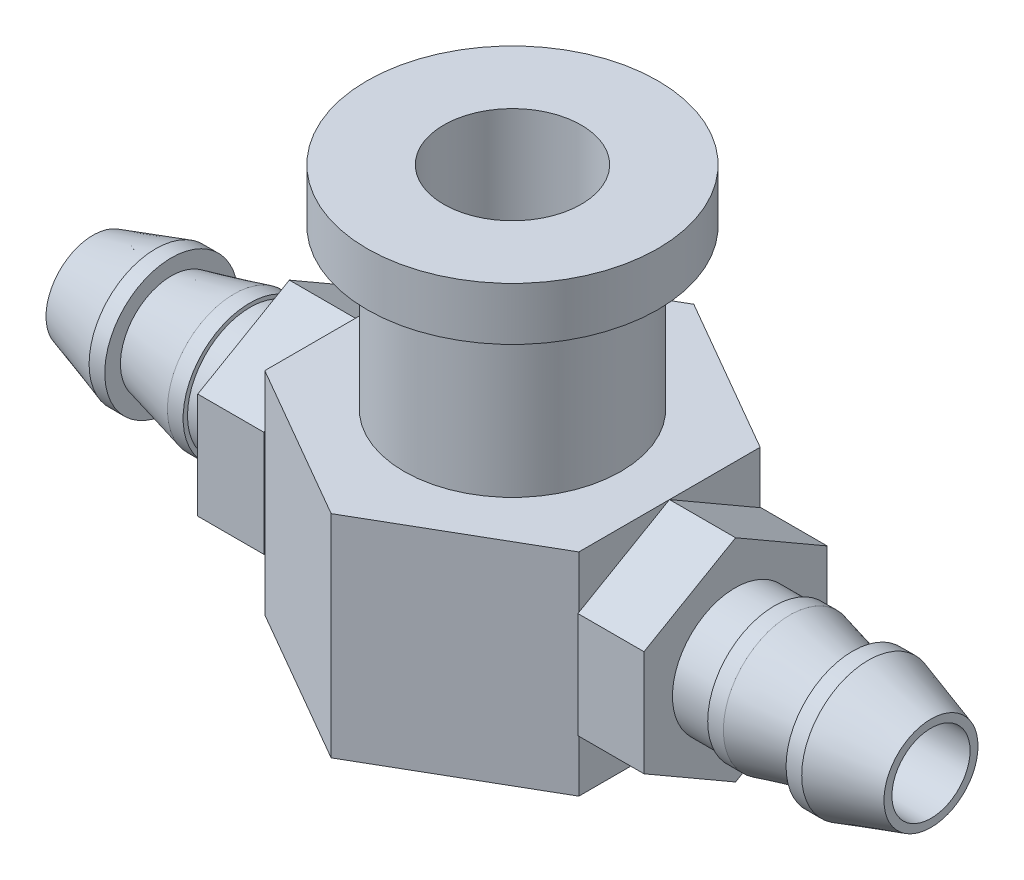
from build123d import *

# Parameters (mm, degrees)
SKETCH1_R            = 5.5
SKETCH1_R_2          = 4.1
BOSS_EXTRUDE1_DEPTH  = 2
SKETCH2_R            = 4.1
BOSS_EXTRUDE2_DEPTH  = 8
SKETCH4_R            = 2.6
BOSS_EXTRUDE3_DEPTH  = 22
BOSS_EXTRUDE4_DEPTH  = 8
BOSS_EXTRUDE5_DEPTH  = 2.5
BOSS_EXTRUDE6_DEPTH  = 2.5
SKETCH8_R            = 2.6
CUT_EXTRUDE1_DEPTH   = 16
SKETCH9_R            = 2.37037037
BOSS_EXTRUDE7_DEPTH  = 1.481481481
SKETCH10_R           = 2.37037037
BOSS_EXTRUDE8_DEPTH  = 1.481481481
SKETCH11_R           = 2.518518519
BOSS_EXTRUDE9_DEPTH  = 0.592592593
SKETCH13_R           = 2.518518519
SKETCH12_R           = 1.925925926
SKETCH14_R           = 2.51851852
BOSS_EXTRUDE10_DEPTH = 0.592592593
SKETCH16_R           = 2.51851852
SKETCH15_R           = 1.77777778
SKETCH17_R           = 1.47777778
CUT_EXTRUDE2_DEPTH   = 31.691734637
SKETCH18_R           = 2.6
CUT_EXTRUDE3_DEPTH   = 6
SKETCH21_R           = 4
CUT_EXTRUDE4_DEPTH   = 2


with BuildPart() as part:
    # Sketch1 → Boss-Extrude1 (new body)
    with BuildSketch(Plane(origin=(0, 0, 0), x_dir=(1, 0, 0), z_dir=(0, 1, 0))):
        with Locations(Location((0, 0, 0), (0, 0, 270))):
            Circle(SKETCH1_R)
        with Locations(Location((0, 0, 0), (0, 0, 270))):
            Circle(SKETCH1_R_2, mode=Mode.SUBTRACT)
    extrude(amount=BOSS_EXTRUDE1_DEPTH)



with BuildPart() as body_2:
    # Sketch2 → Boss-Extrude2 (new body)
    with BuildSketch(Plane(origin=(0, 2, 0), x_dir=(1, 0, 0), z_dir=(0, 1, 0))):
        with Locations(Location((0, 0, 0), (0, 0, 270))):
            Circle(SKETCH2_R)
    extrude(amount=-BOSS_EXTRUDE2_DEPTH)


with BuildPart() as part_1:
    add(part.part)

    add(body_2.part)  # Boss-Extrude3 merges body 2
    # Sketch4 → Boss-Extrude3 (add)
    with BuildSketch(Plane(origin=(0, 2, 0), x_dir=(1, 0, 0), z_dir=(0, 1, 0))):
        with Locations(Location((0, 0, 0), (0, 0, 270))):
            Circle(SKETCH4_R)
    extrude(amount=-BOSS_EXTRUDE3_DEPTH)

    # Sketch5 → Boss-Extrude4 (add)
    with BuildSketch(Plane.XZ.offset(6)):
        Polygon((5.938459912, -3.428571429), (5.938459912, 3.428571429), (0, 6.857142857), (-5.938459912, 3.428571429), (-5.938459912, -3.428571429), (0, -6.857142857), align=None)
    extrude(amount=BOSS_EXTRUDE4_DEPTH)

    # Sketch6 → Boss-Extrude5 (add)
    with BuildSketch(Plane(origin=(5.938459912, 0, 0), x_dir=(0, 0, -1), z_dir=(1, 0, 0))):
        Polygon((0, -14), (3.464101615, -12), (3.464101615, -8), (0, -6), (-3.464101615, -8), (-3.464101615, -12), align=None)
    extrude(amount=BOSS_EXTRUDE5_DEPTH)

    # Sketch7 → Boss-Extrude6 (add)
    with BuildSketch(Plane.ZY.offset(5.938459912)):
        Polygon((0, -14), (3.464101615, -12), (3.464101615, -8), (0, -6), (-3.464101615, -8), (-3.464101615, -12), align=None)
    extrude(amount=BOSS_EXTRUDE6_DEPTH)

    # Sketch8 → Cut-Extrude1 (cut)
    with BuildSketch(Plane(origin=(0, 2, 0), x_dir=(1, 0, 0), z_dir=(0, 1, 0))):
        with Locations(Location((0, 0, 0), (0, 0, 270))):
            Circle(SKETCH8_R)
    extrude(amount=-CUT_EXTRUDE1_DEPTH, mode=Mode.SUBTRACT)


with BuildPart() as cut_extrude1_piece_1:
    # of the separate pieces the step leaves, piece 1, a body of its own (cut_extrude1_pieces)
    add(part_1.part.solids().sort_by_distance((0, 2, 5.5))[0])

    # Sketch9 → Boss-Extrude7 (add)
    with BuildSketch(Plane(origin=(8.438459912, 0, 0), x_dir=(0, 0, -1), z_dir=(1, 0, 0))):
        with Locations((-0.017765093, -10)):
            Circle(SKETCH9_R)
    extrude(amount=BOSS_EXTRUDE7_DEPTH)

    # Sketch10 → Boss-Extrude8 (add)
    with BuildSketch(Plane.ZY.offset(8.438459912)):
        with Locations((0, -10)):
            Circle(SKETCH10_R)
    extrude(amount=BOSS_EXTRUDE8_DEPTH)

    # Sketch11 → Boss-Extrude9 (add)
    with BuildSketch(Plane(origin=(9.919941393, 0, 0), x_dir=(0, 0, -1), z_dir=(1, 0, 0))):
        with Locations((-0.017765093, -10)):
            Circle(SKETCH11_R)
    boss_extrude9 = extrude(amount=BOSS_EXTRUDE9_DEPTH)

    # Sketch13 → Loft1 section 0
    with BuildSketch(Plane(origin=(10.512533986, 0, 0), x_dir=(0, 0, -1), z_dir=(1, 0, 0))):
        with Locations((-0.017765093, -10)):
            Circle(SKETCH13_R)
    # Sketch12 → Loft1 section 1
    with BuildSketch(Plane(origin=(12.882904356, 0, 0), x_dir=(0, 0, -1), z_dir=(1, 0, 0))):
        with Locations((-0.017765093, -10)):
            Circle(SKETCH12_R)
    loft1 = loft()

    # Sketch14 → Boss-Extrude10 (add)
    with BuildSketch(Plane(origin=(12.882904356, 0, 0), x_dir=(0, 0, -1), z_dir=(1, 0, 0))):
        with Locations(Location((-0.017765093, -10, 0), (0, 0, 180))):
            Circle(SKETCH14_R)
    boss_extrude10 = extrude(amount=BOSS_EXTRUDE10_DEPTH)

    # Sketch16 → Loft2 section 0
    with BuildSketch(Plane(origin=(13.475496948, 0, 0), x_dir=(0, 0, -1), z_dir=(1, 0, 0))):
        with Locations((-0.017765093, -10)):
            Circle(SKETCH16_R)
    # Sketch15 → Loft2 section 1
    with BuildSketch(Plane(origin=(15.845867318, 0, 0), x_dir=(0, 0, -1), z_dir=(1, 0, 0))):
        with Locations((-0.017765093, -10)):
            Circle(SKETCH15_R)
    loft2 = loft()

    # Mirror1: Boss-Extrude9, Loft1, Boss-Extrude10, Loft2 across plane
    add(boss_extrude9.mirror(Plane(origin=(0, 0, 0), x_dir=(0, 0, 1), z_dir=(1, 0, 0))))
    add(loft1.mirror(Plane(origin=(0, 0, 0), x_dir=(0, 0, 1), z_dir=(1, 0, 0))))
    add(boss_extrude10.mirror(Plane(origin=(0, 0, 0), x_dir=(0, 0, 1), z_dir=(1, 0, 0))))
    add(loft2.mirror(Plane(origin=(0, 0, 0), x_dir=(0, 0, 1), z_dir=(1, 0, 0))))

    # Sketch17 → Cut-Extrude2 (cut)
    with BuildSketch(Plane(origin=(15.845867318, 0, 0), x_dir=(0, 0, -1), z_dir=(1, 0, 0))):
        with Locations((-0.017765093, -10)):
            Circle(SKETCH17_R)
    extrude(amount=-CUT_EXTRUDE2_DEPTH, mode=Mode.SUBTRACT)

    # Sketch21 → Cut-Extrude4 (cut)
    with BuildSketch(Plane.XZ.offset(14)):
        with Locations(Location((0, 0, 0), (0, 0, 270))):
            Circle(SKETCH21_R)
    extrude(amount=-CUT_EXTRUDE4_DEPTH, mode=Mode.SUBTRACT)


with BuildPart() as cut_extrude1_piece_2:
    # of the separate pieces the step leaves, piece 2, a body of its own (cut_extrude1_pieces)
    add(part_1.part.solids().sort_by_distance((0, -20, 2.6))[0])

    # Sketch18 → Cut-Extrude3 (cut)
    with BuildSketch(Plane.XZ.offset(20)):
        with Locations(Location((0, 0, 0), (0, 0, 90))):
            Circle(SKETCH18_R)
    extrude(amount=-CUT_EXTRUDE3_DEPTH, mode=Mode.SUBTRACT)


solid = cut_extrude1_piece_1.part
